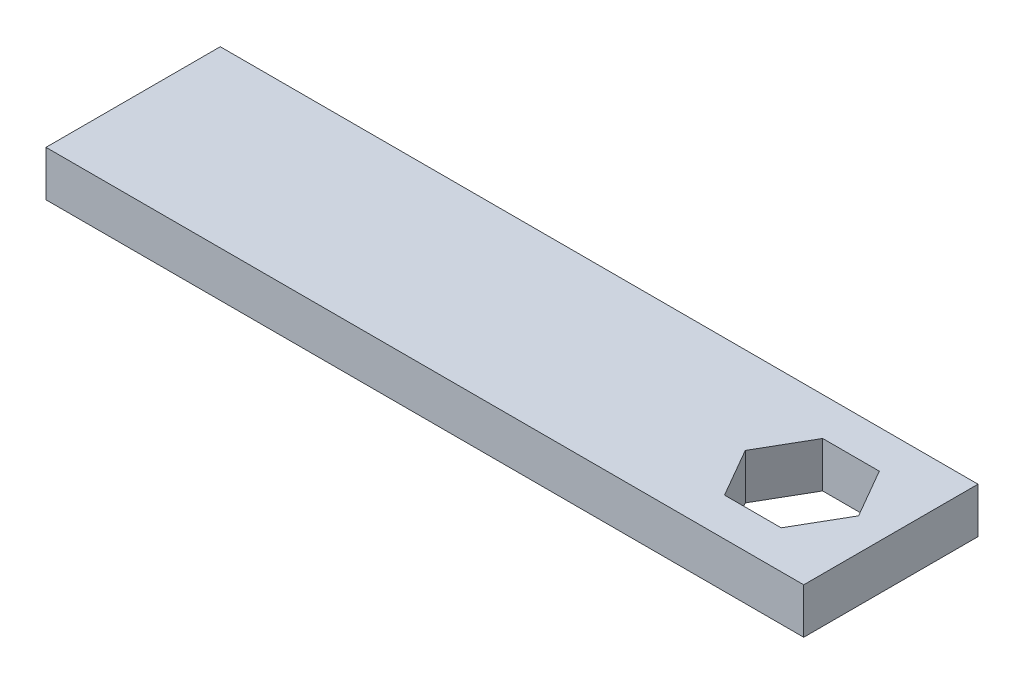
from build123d import *

# Parameters (mm, degrees)
SZKIC2_W                    = 100
SZKIC2_H                    = 23
DODANIE_WYCI_GNI_CIE1_DEPTH = 6
WYTNIJ_WYCI_GNI_CIE1_DEPTH  = 6


with BuildPart() as part:
    # Szkic2 → Dodanie-wyciągnięcie1 (new body)
    with BuildSketch(Plane(origin=(0, 6, 0), x_dir=(1, 0, 0), z_dir=(0, 1, 0))):
        with Locations((34.15799092, -176.577789634)):
            Rectangle(SZKIC2_W, SZKIC2_H)
    extrude(amount=-DODANIE_WYCI_GNI_CIE1_DEPTH)

    # Szkic3 → Wytnij-wyciągnięcie1 (cut)
    with BuildSketch(Plane(origin=(0, 6, 0), x_dir=(1, 0, 0), z_dir=(0, 1, 0))):
        Polygon((64.942961941, -176.577789634), (68.681304934, -183.052789634), (76.15799092, -183.052789634), (79.896333913, -176.577789634), (76.15799092, -170.102789634), (68.681304934, -170.102789634), align=None)
    extrude(amount=-WYTNIJ_WYCI_GNI_CIE1_DEPTH, mode=Mode.SUBTRACT)


solid = part.part
